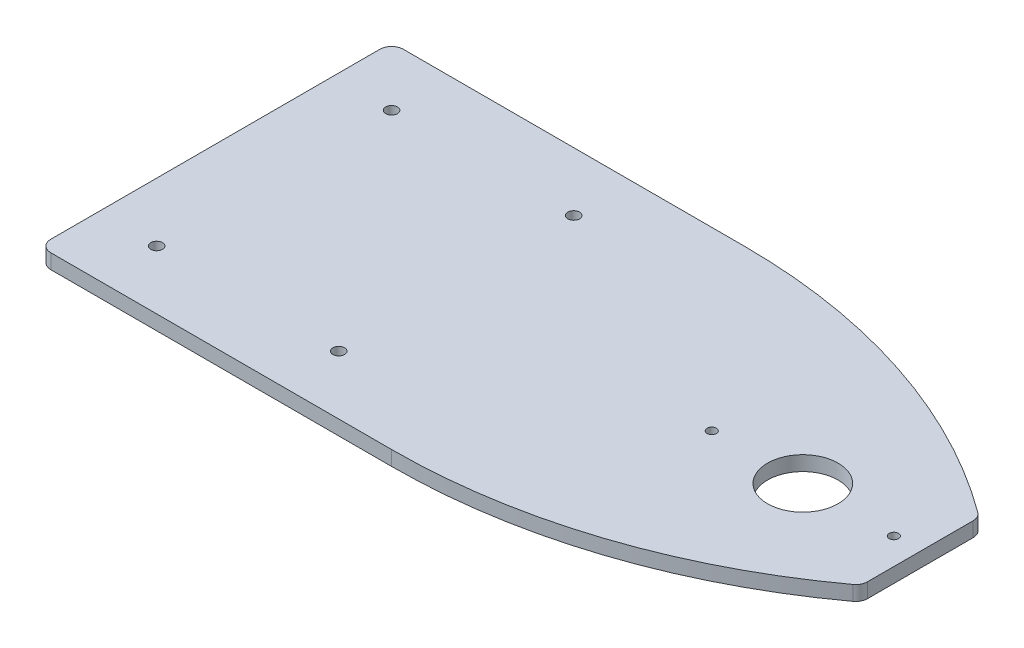
from build123d import *

# Parameters (mm, degrees)
SKETCH1_W           = 152.4
SKETCH1_H           = 76.2
BOSS_EXTRUDE1_DEPTH = 3.175
CUT_EXTRUDE1_DEPTH  = 3.175
FILLET2_R           = 2.54
FILLET3_R           = 2.54
SKETCH5_R           = 7.62
CUT_EXTRUDE2_DEPTH  = 3.175
SKETCH6_R           = 1.27
CUT_EXTRUDE3_DEPTH  = 3.175
SKETCH7_R           = 1.0033
CUT_EXTRUDE4_DEPTH  = 86.253332046


with BuildPart() as part:
    # Sketch1 → Boss-Extrude1 (new body)
    with BuildSketch(Plane(origin=(0, 0, 0), x_dir=(1, 0, 0), z_dir=(0, 1, 0))):
        Rectangle(SKETCH1_W, SKETCH1_H)
    extrude(amount=BOSS_EXTRUDE1_DEPTH)

    # Sketch4 → Cut-Extrude1 (cut)
    with BuildSketch(Plane(origin=(0, 3.175, 0), x_dir=(1, 0, 0), z_dir=(0, 1, 0))):
        with BuildLine():
            Line((0, 38.1), (76.2, 38.1))
            Line((76.2, 38.1), (76.2, 12.7))
            ThreePointArc((76.2, 12.7), (40.160926284, 31.582778852), (0, 38.1))
        make_face()
        with BuildLine():
            Line((76.2, -38.1), (76.2, -12.7))
            ThreePointArc((76.2, -12.7), (40.160926284, -31.582778852), (0, -38.1))
            Line((0, -38.1), (76.2, -38.1))
        make_face()
    extrude(amount=-CUT_EXTRUDE1_DEPTH, mode=Mode.SUBTRACT)

    # Fillet2
    fillet2_edges = [part.edges().sort_by_distance(p)[0] for p in [
        (76.2, 1.5875, -12.7),
        (76.2, 1.5875, 12.7),
    ]]
    fillet(fillet2_edges, radius=FILLET2_R)

    # Fillet3
    fillet3_edges = [part.edges().sort_by_distance(p)[0] for p in [
        (-76.2, 1.5875, -38.1),
        (-76.2, 1.5875, 38.1),
    ]]
    fillet(fillet3_edges, radius=FILLET3_R)

    # Sketch5 → Cut-Extrude2 (cut)
    with BuildSketch(Plane(origin=(0, 3.175, 0), x_dir=(1, 0, 0), z_dir=(0, 1, 0))):
        with Locations(Location((50.8, 0, 0), (0, 0, 270))):
            Circle(SKETCH5_R)
    extrude(amount=-CUT_EXTRUDE2_DEPTH, mode=Mode.SUBTRACT)

    # Sketch6 → Cut-Extrude3 (cut)
    with BuildSketch(Plane(origin=(0, 3.175, 0), x_dir=(1, 0, 0), z_dir=(0, 1, 0))):
        with Locations(Location((-63.5, 25.4, 0), (0, 0, 270))):
            Circle(SKETCH6_R)
        with Locations(Location((-63.5, -25.4, 0), (0, 0, 270))):
            Circle(SKETCH6_R)
        with Locations(Location((-24.13, 25.4, 0), (0, 0, 270))):
            Circle(SKETCH6_R)
        with Locations(Location((-24.13, -25.4, 0), (0, 0, 270))):
            Circle(SKETCH6_R)
    extrude(amount=-CUT_EXTRUDE3_DEPTH, mode=Mode.SUBTRACT)

    # Sketch7 → Cut-Extrude4 (cut, through all)
    with BuildSketch(Plane(origin=(0, 3.175, 0), x_dir=(1, 0, 0), z_dir=(0, 1, 0))):
        with Locations(Location((70.485, 0, 0), (0, 0, 270))):
            Circle(SKETCH7_R)
        with Locations(Location((31.115, 0, 0), (0, 0, 270))):
            Circle(SKETCH7_R)
    extrude(amount=-CUT_EXTRUDE4_DEPTH, mode=Mode.SUBTRACT)


solid = part.part
